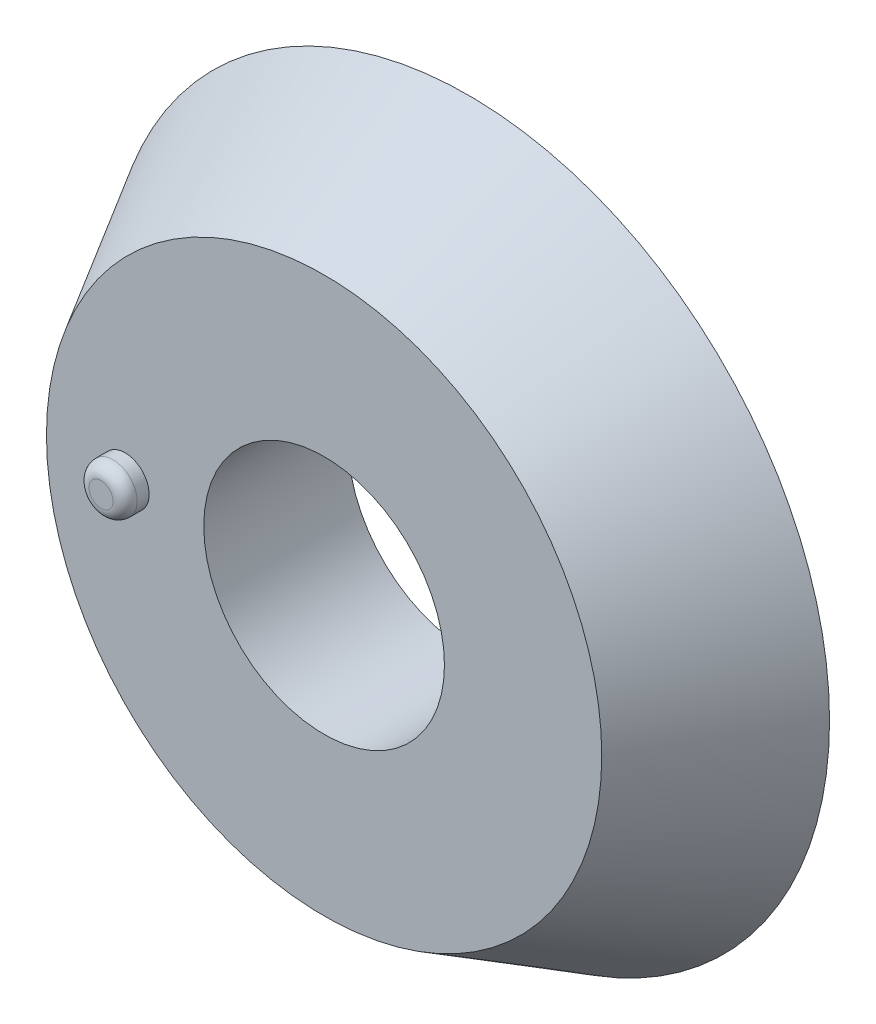
from build123d import *

# Parameters (mm, degrees)
SKETCH_1_R               = 75
EXTRUDE_1_DEPTH          = 30
EXTRUDE_1_TAPER          = 30
CUT_EXTRUDE_1_DEPTH      = 111.227038425
CUT_EXTRUDE_1_DEPTH_BACK = 111.227038425
SKETCH_2_R               = 25
EXTRUDE_2_DEPTH          = 5
FILLET_1_R               = 2.5


with BuildPart() as part:
    # 스케치1 → 보스-돌출1 (new body)
    with BuildSketch(Plane.XY):
        Circle(SKETCH_1_R)
    extrude(amount=EXTRUDE_1_DEPTH, taper=EXTRUDE_1_TAPER)

    # 스케치2 → 컷-돌출1 (cut, two sides: drawn at the far end of the back side and taken through both)
    with BuildSketch(Plane.XY.offset(30).offset(-CUT_EXTRUDE_1_DEPTH_BACK)):
        Circle(SKETCH_2_R)
    extrude(amount=CUT_EXTRUDE_1_DEPTH + CUT_EXTRUDE_1_DEPTH_BACK, mode=Mode.SUBTRACT)

    # 스케치3 → 보스-돌출2 (add)
    with BuildSketch(Plane.XY.offset(30)):
        with BuildLine():
            ThreePointArc((-46.339745962, 0), (-41.339745962, -5), (-36.339745962, 0))
            Line((-36.339745962, 0), (-46.339745962, 0))
        make_face()
        with BuildLine():
            Line((-46.339745962, 0), (-36.339745962, 0))
            ThreePointArc((-36.339745962, 0), (-41.339745962, 5), (-46.339745962, 0))
        make_face()
    extrude(amount=EXTRUDE_2_DEPTH)

    # 필렛1
    fillet_1_edges = [part.edges().sort_by_distance(p)[0] for p in [
        (-46.339745962, 0, 35),
    ]]
    fillet(fillet_1_edges, radius=FILLET_1_R)


solid = part.part
